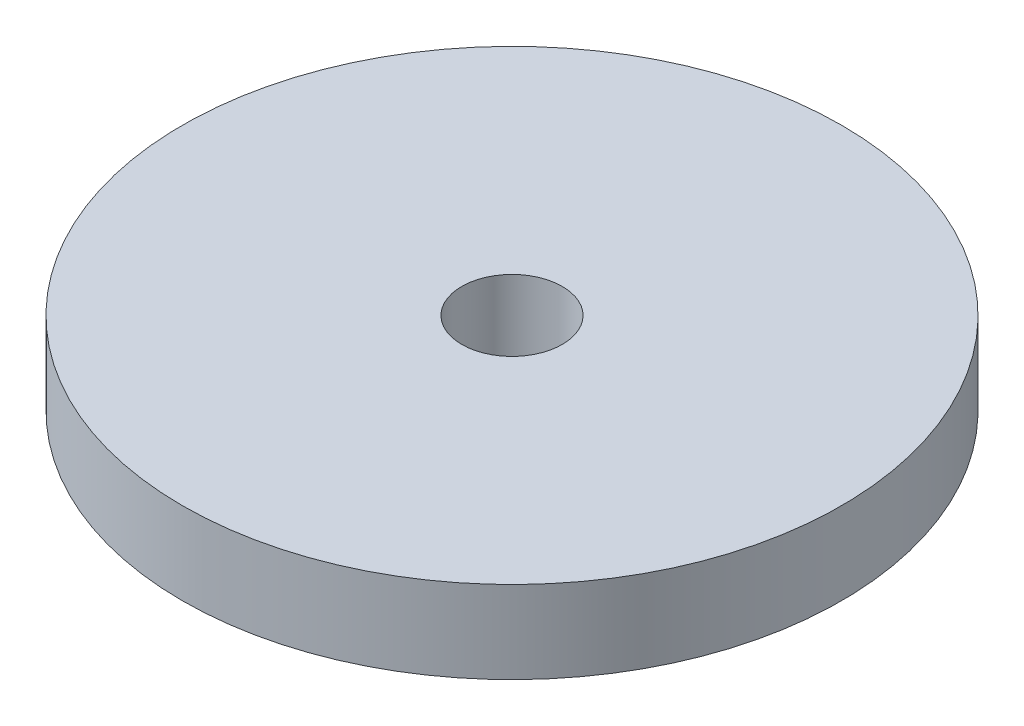
from build123d import *

# Parameters (mm, degrees)
SKETCH_1_R      = 40
SKETCH_1_R_2    = 6.1
EXTRUDE_1_DEPTH = 10


with BuildPart() as part:
    # Эскиз1 → Бобышка-Вытянуть1 (new body)
    with BuildSketch(Plane(origin=(0, 0, 0), x_dir=(1, 0, 0), z_dir=(0, 1, 0))):
        with Locations(Location((0, 0, 0), (0, 0, 270))):
            Circle(SKETCH_1_R)
        with Locations(Location((0, 0, 0), (0, 0, 270))):
            Circle(SKETCH_1_R_2, mode=Mode.SUBTRACT)
    extrude(amount=EXTRUDE_1_DEPTH)


solid = part.part
